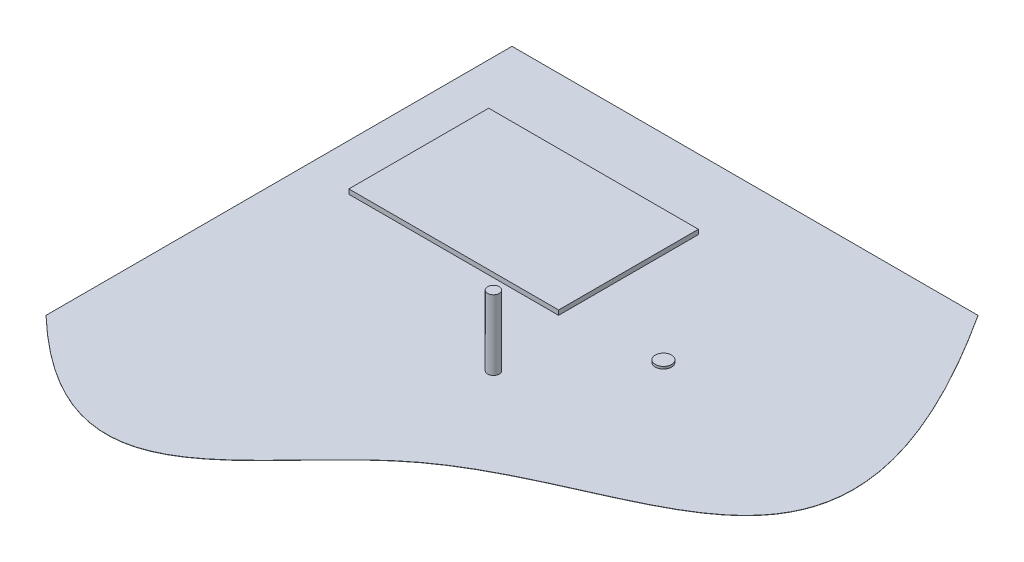
from build123d import *

# Parameters (mm, degrees)
EXTRUDE_1_DEPTH = 10
SKETCH_2_W      = 9000
SKETCH_2_H      = 6000
EXTRUDE_2_DEPTH = 200
SKETCH_3_R      = 350
EXTRUDE_3_DEPTH = 100
SKETCH_4_R      = 250
EXTRUDE_4_DEPTH = 3000


with BuildPart() as part:
    # Эскиз1 → Бобышка-Вытянуть1 (new body)
    with BuildSketch(Plane(origin=(0, 0, 0), x_dir=(1, 0, 0), z_dir=(0, 1, 0))):
        with BuildLine():
            Line((0, 0), (20000, 0))
            add(Edge.make_bspline(
                [(0, -20000), (7198.35283971, -26864.519570208), (12070.505785396, -12028.818977693), (29348.40206024, -14440.696342407), (20000, 0)],
                knots=[0, 0, 0, 0, 0.41355972, 1, 1, 1, 1], degree=3))
            Line((0, -20000), (0, 0))
        make_face()
    extrude(amount=EXTRUDE_1_DEPTH)

    # Эскиз2 → Бобышка-Вытянуть2 (add)
    with BuildSketch(Plane(origin=(0, 10, 0), x_dir=(1, 0, 0), z_dir=(0, 1, 0))):
        with Locations((6500, -6000)):
            Rectangle(SKETCH_2_W, SKETCH_2_H)
    extrude(amount=EXTRUDE_2_DEPTH)


with BuildPart() as body_2:
    # Эскиз3 → Бобышка-Вытянуть3 (new body)
    with BuildSketch(Plane(origin=(0, 10, 0), x_dir=(1, 0, 0), z_dir=(0, 1, 0))):
        with Locations(Location((15000, -8500, 0), (0, 0, 270))):
            Circle(SKETCH_3_R)
    extrude(amount=EXTRUDE_3_DEPTH)


with BuildPart() as body_3:
    # Эскиз4 → Бобышка-Вытянуть4 (new body)
    with BuildSketch(Plane(origin=(0, 10, 0), x_dir=(1, 0, 0), z_dir=(0, 1, 0))):
        with Locations(Location((11661.589659751, -12457.685557089, 0), (0, 0, 270))):
            Circle(SKETCH_4_R)
    extrude(amount=EXTRUDE_4_DEPTH)


solid = Compound([part.part, body_2.part, body_3.part])
